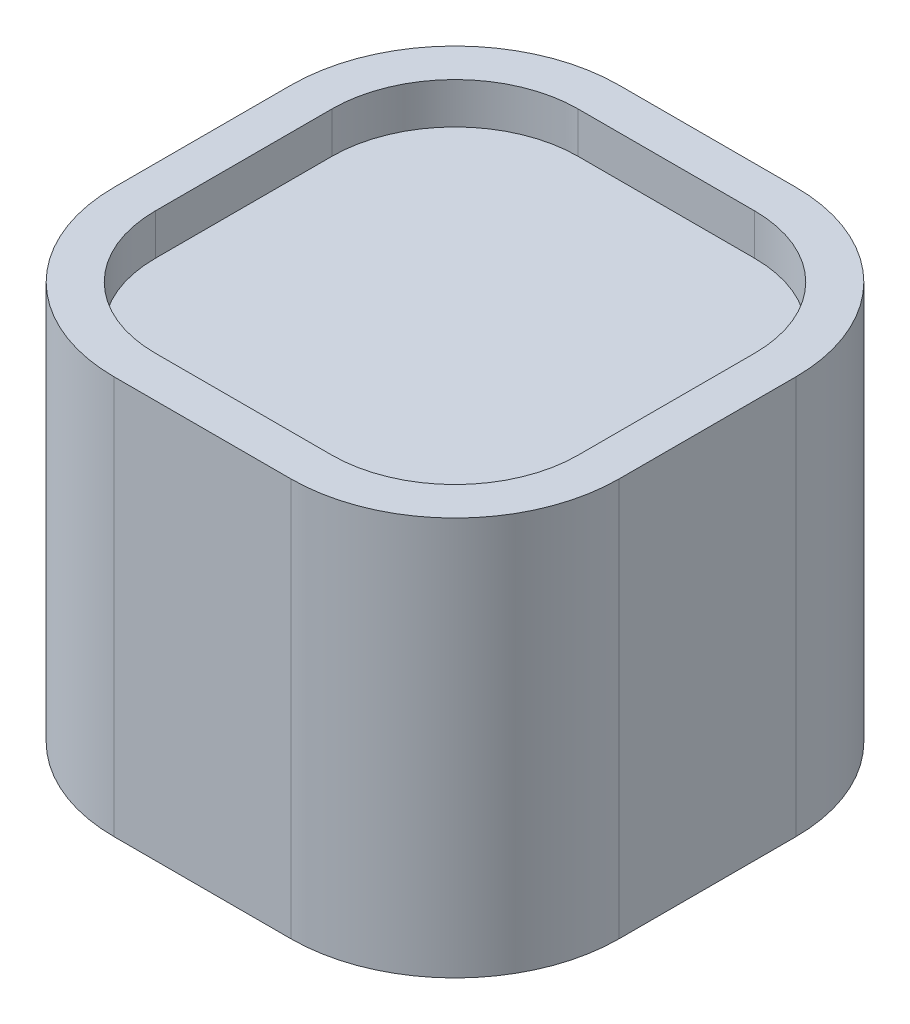
from build123d import *

# Parameters (mm, degrees)
SKETCH_1_W          = 123
SKETCH_1_H          = 123
EXTRUDE_1_DEPTH     = 97
FILLET_1_R          = 40
FILLET_2_R          = 40
FILLET_3_R          = 40
FILLET_4_R          = 40
CUT_EXTRUDE_1_DEPTH = 10


with BuildPart() as part:
    # 스케치1 → 보스-돌출1 (new body)
    with BuildSketch(Plane(origin=(0, 0, 0), x_dir=(1, 0, 0), z_dir=(0, 1, 0))):
        Rectangle(SKETCH_1_W, SKETCH_1_H)
    extrude(amount=EXTRUDE_1_DEPTH)

    # 필렛1
    fillet_1_edges = [part.edges().sort_by_distance(p)[0] for p in [
        (-61.5, 48.5, -61.5),
    ]]
    fillet(fillet_1_edges, radius=FILLET_1_R)

    # 필렛2
    fillet_2_edges = [part.edges().sort_by_distance(p)[0] for p in [
        (61.5, 48.5, -61.5),
    ]]
    fillet(fillet_2_edges, radius=FILLET_2_R)

    # 필렛3
    fillet_3_edges = [part.edges().sort_by_distance(p)[0] for p in [
        (61.5, 48.5, 61.5),
    ]]
    fillet(fillet_3_edges, radius=FILLET_3_R)

    # 필렛4
    fillet_4_edges = [part.edges().sort_by_distance(p)[0] for p in [
        (-61.5, 48.5, 61.5),
    ]]
    fillet(fillet_4_edges, radius=FILLET_4_R)

    # 스케치2 → 컷-돌출1 (cut)
    with BuildSketch(Plane(origin=(0, 97, 0), x_dir=(1, 0, 0), z_dir=(0, 1, 0))):
        with BuildLine():
            Line((21.5, 51.5), (-21.5, 51.5))
            ThreePointArc((-21.5, 51.5), (-42.713203436, 42.713203436), (-51.5, 21.5))
            Line((-51.5, 21.5), (-51.5, -21.5))
            ThreePointArc((-51.5, -21.5), (-42.713203436, -42.713203436), (-21.5, -51.5))
            Line((-21.5, -51.5), (21.5, -51.5))
            ThreePointArc((21.5, -51.5), (42.713203436, -42.713203436), (51.5, -21.5))
            Line((51.5, -21.5), (51.5, 21.5))
            ThreePointArc((51.5, 21.5), (42.713203436, 42.713203436), (21.5, 51.5))
        make_face()
    extrude(amount=-CUT_EXTRUDE_1_DEPTH, mode=Mode.SUBTRACT)


solid = part.part
